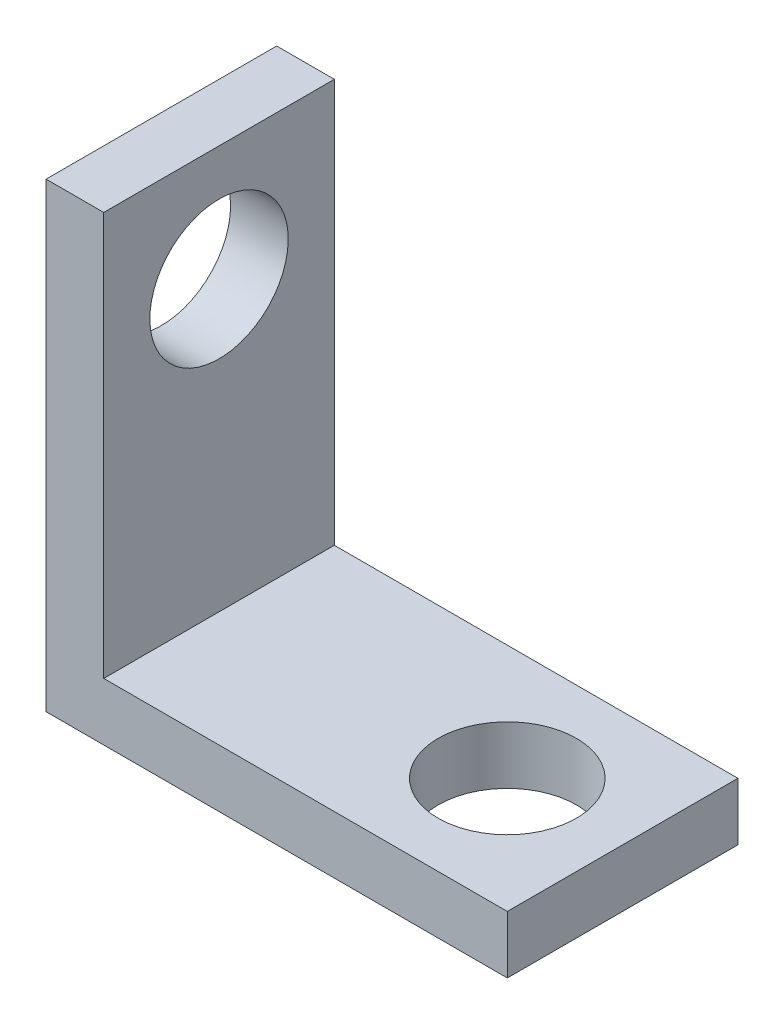
from build123d import *

# Parameters (mm, degrees)
BOSS_EXTRUDE1_DEPTH = 12.7
SKETCH2_R           = 3.81
CUT_EXTRUDE1_DEPTH  = 12.7
SKETCH3_R           = 3.81
CUT_EXTRUDE2_DEPTH  = 12.7


with BuildPart() as part:
    # Sketch1 → Boss-Extrude1 (new body)
    with BuildSketch(Plane.XY):
        Polygon((0, 0), (0, 25.4), (3.175, 25.4), (3.175, 3.175), (25.4, 3.175), (25.4, 0), align=None)
    extrude(amount=BOSS_EXTRUDE1_DEPTH)

    # Sketch2 → Cut-Extrude1 (cut)
    with BuildSketch(Plane(origin=(0, 3.175, 0), x_dir=(1, 0, 0), z_dir=(0, 1, 0))):
        with Locations(Location((19.05, -6.35, 0), (0, 0, 180))):
            Circle(SKETCH2_R)
    extrude(amount=-CUT_EXTRUDE1_DEPTH, mode=Mode.SUBTRACT)

    # Sketch3 → Cut-Extrude2 (cut)
    with BuildSketch(Plane(origin=(3.175, 0, 0), x_dir=(0, 0, -1), z_dir=(1, 0, 0))):
        with Locations(Location((-6.35, 19.05, 0), (0, 0, 90))):
            Circle(SKETCH3_R)
    extrude(amount=-CUT_EXTRUDE2_DEPTH, mode=Mode.SUBTRACT)


solid = part.part
